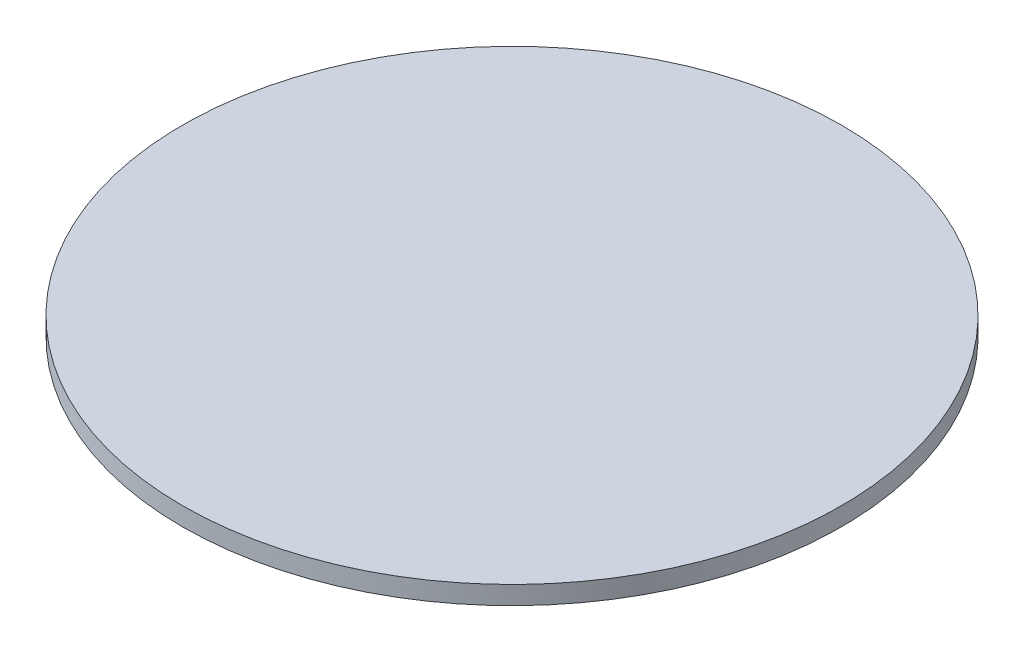
from build123d import *

# Parameters (mm, degrees)
SKETCH_1_R      = 17.95
EXTRUDE_1_DEPTH = 1


with BuildPart() as part:
    # 草图1 → 凸台-拉伸1 (new body)
    with BuildSketch(Plane(origin=(0, 0, 0), x_dir=(1, 0, 0), z_dir=(0, 1, 0))):
        with Locations(Location((0, 0, 0), (0, 0, 270))):
            Circle(SKETCH_1_R)
    extrude(amount=EXTRUDE_1_DEPTH)


solid = part.part
